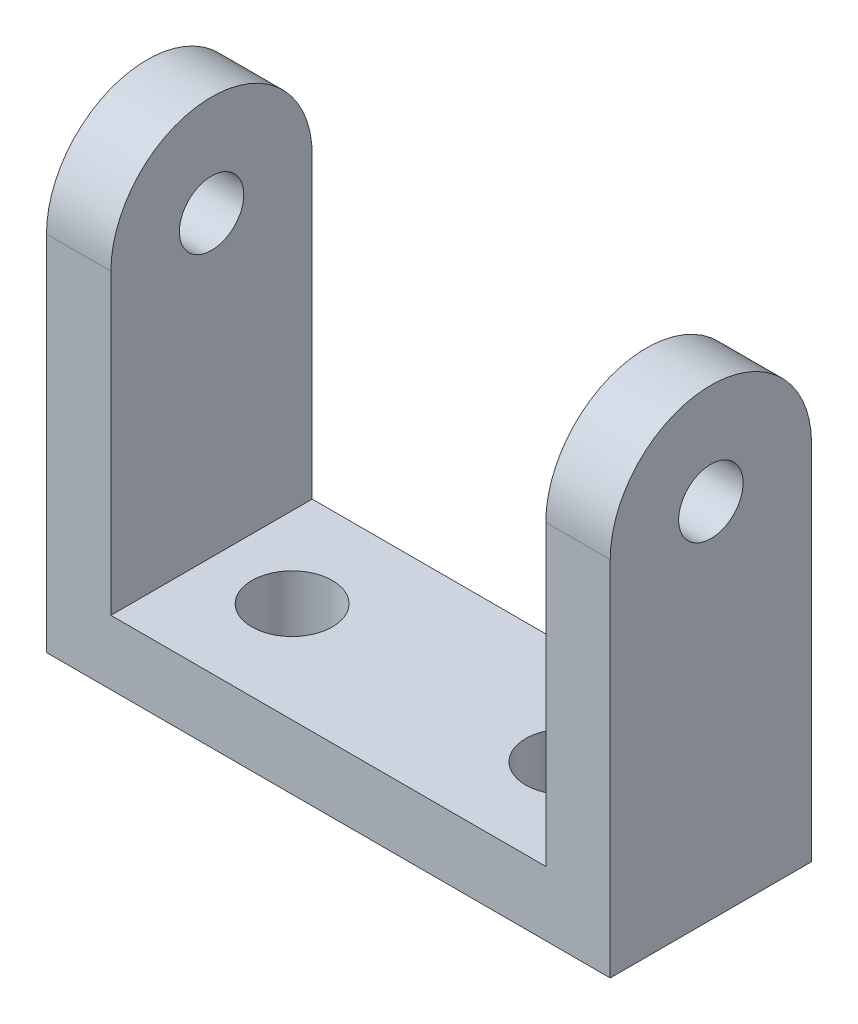
from build123d import *

# Parameters (mm, degrees)
EXTRUDE_THIN1_DEPTH        = 25
BOSS_EXTRUDE1_DEPTH        = 8
F_8_0_8_DIAMETER_HOLE1_D   = 8
F_10_0_10_DIAMETER_HOLE1_D = 10


with BuildPart() as part:
    # Sketch2 → Extrude-Thin1 (new body)
    with BuildSketch(Plane.XY):
        Polygon((0, 0), (35, 0), (35, 45), (27, 45), (27, 8), (0, 8), align=None)
    extrude_thin1 = extrude(amount=-EXTRUDE_THIN1_DEPTH)

    # Sketch3 → Boss-Extrude1 (add)
    with BuildSketch(Plane(origin=(35, 0, 0), x_dir=(0, 0, -1), z_dir=(1, 0, 0))):
        with BuildLine():
            Line((25, 45), (0, 45))
            ThreePointArc((0, 45), (12.5, 57.5), (25, 45))
        make_face()
    boss_extrude1 = extrude(amount=-BOSS_EXTRUDE1_DEPTH)

    # Ø8.0 (8) Diameter Hole1 (through all)
    with Locations(Plane(origin=(35, 45, -12.5), x_dir=(0, 0, 1), z_dir=(1, 0, 0))):
        with Locations((0, 0)):
            f_8_0_8_diameter_hole1 = Hole(F_8_0_8_DIAMETER_HOLE1_D / 2)

    # Ø10.0 (10) Diameter Hole1 (through all)
    with Locations(Plane(origin=(17, 8, -12.5), x_dir=(0, 0, 1), z_dir=(0, 1, 0))):
        with Locations((0, 0)):
            f_10_0_10_diameter_hole1 = Hole(F_10_0_10_DIAMETER_HOLE1_D / 2)

    # Mirror1: Extrude-Thin1, Boss-Extrude1, Ø8.0 (8) Diameter Hole1, Ø10.0 (10) Diameter Hole1 across plane
    add(extrude_thin1.mirror(Plane(origin=(0, 0, -25), x_dir=(0, 0, 1), z_dir=(1, 0, 0))))
    add(boss_extrude1.mirror(Plane(origin=(0, 0, -25), x_dir=(0, 0, 1), z_dir=(1, 0, 0))))
    add(f_8_0_8_diameter_hole1.mirror(Plane(origin=(0, 0, -25), x_dir=(0, 0, 1), z_dir=(1, 0, 0))), mode=Mode.SUBTRACT)
    add(f_10_0_10_diameter_hole1.mirror(Plane(origin=(0, 0, -25), x_dir=(0, 0, 1), z_dir=(1, 0, 0))), mode=Mode.SUBTRACT)


solid = part.part
